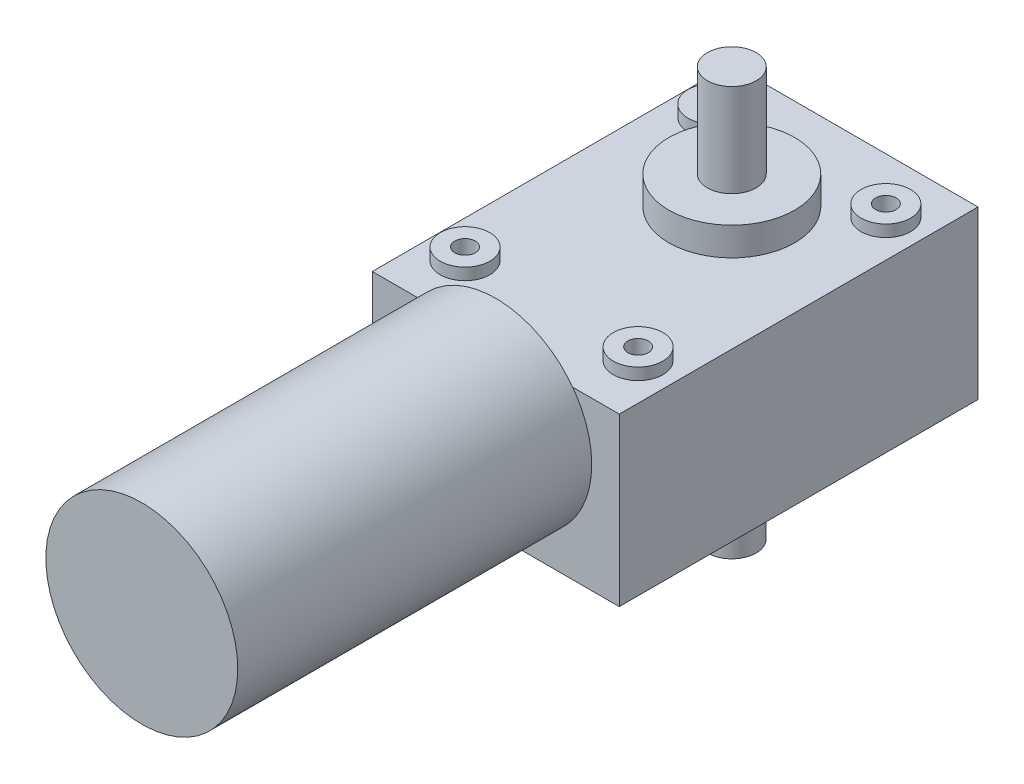
from build123d import *

# Parameters (mm, degrees)
SKETCH1_W            = 39.878
SKETCH1_H            = 57.912
BOSS_EXTRUDE1_DEPTH  = 26.924
SKETCH22_R           = 0.508
BOSS_EXTRUDE9_DEPTH  = 0.508
SKETCH3_R            = 10.16
BOSS_EXTRUDE2_DEPTH  = 4.572
BOSS_EXTRUDE3_START  = 4.572
SKETCH4_R            = 10.16
BOSS_EXTRUDE3_DEPTH  = 4.572
SKETCH5_R            = 3.937
BOSS_EXTRUDE4_DEPTH  = 14.986
BOSS_EXTRUDE5_START  = 14.986
SKETCH7_R            = 3.937
BOSS_EXTRUDE5_DEPTH  = 14.986
SKETCH8_R            = 15.494
BOSS_EXTRUDE6_DEPTH  = 57.15
SKETCH10_R           = 4.0005
BOSS_EXTRUDE7_DEPTH  = 1.905
LPATTERN1_COUNT      = 2
LPATTERN1_PITCH      = 40.00000128
LPATTERN1_COUNT_DIR2 = 2
LPATTERN1_PITCH_DIR2 = 27.94
BOSS_EXTRUDE8_START  = 1.905
SKETCH18_R           = 4.0005
BOSS_EXTRUDE8_DEPTH  = 1.905
LPATTERN3_COUNT      = 2
LPATTERN3_PITCH      = 27.94
LPATTERN3_COUNT_DIR2 = 2
LPATTERN3_PITCH_DIR2 = 40.00000128


with BuildPart() as part:
    # Sketch1 → Boss-Extrude1 (new body)
    with BuildSketch(Plane(origin=(0, 0, 0), x_dir=(1, 0, 0), z_dir=(0, 1, 0))):
        with Locations((19.939, 28.956)):
            Rectangle(SKETCH1_W, SKETCH1_H)
    extrude(amount=BOSS_EXTRUDE1_DEPTH)

    # Sketch3 → Boss-Extrude2 (add)
    with BuildSketch(Plane(origin=(0, 26.924, 0), x_dir=(1, 0, 0), z_dir=(0, 1, 0))):
        with Locations(Location((19.939, 38.1, 0), (0, 0, 270))):
            Circle(SKETCH3_R)
    extrude(amount=BOSS_EXTRUDE2_DEPTH)

    # Sketch4 → Boss-Extrude3 (add)
    with BuildSketch(Plane.XZ.offset(BOSS_EXTRUDE3_START)):
        with Locations(Location((19.939, -38.1, 0), (0, 0, 90))):
            Circle(SKETCH4_R)
    extrude(amount=-BOSS_EXTRUDE3_DEPTH)

    # Sketch5 → Boss-Extrude4 (add)
    with BuildSketch(Plane(origin=(0, 31.496, 0), x_dir=(1, 0, 0), z_dir=(0, 1, 0))):
        with Locations(Location((19.939, 38.1, 0), (0, 0, 270))):
            Circle(SKETCH5_R)
    extrude(amount=BOSS_EXTRUDE4_DEPTH)

    # Sketch7 → Boss-Extrude5 (add)
    with BuildSketch(Plane.XZ.offset(4.572).offset(BOSS_EXTRUDE5_START)):
        with Locations(Location((19.939, -38.1, 0), (0, 0, 90))):
            Circle(SKETCH7_R)
    extrude(amount=-BOSS_EXTRUDE5_DEPTH)

    # Sketch10 → Boss-Extrude7 (add)
    with BuildSketch(Plane(origin=(0, 26.924, 0), x_dir=(1, 0, 0), z_dir=(0, 1, 0))):
        with Locations(Location((5.9563, 9.017, 0), (0, 0, 90))):
            Circle(SKETCH10_R)
    boss_extrude7 = extrude(amount=BOSS_EXTRUDE7_DEPTH)

    # Sketch16 → M4x0.7 Tapped Hole1 (revolve, cut)
    with BuildSketch(Plane(origin=(5.9563, 28.829, -9.017), x_dir=(0, 0, 1), z_dir=(1, 0, 0))):
        Polygon((0, 0), (0, 10.008420021), (1.65, 9.017), (1.65, 0), align=None)
    m4x0_7_tapped_hole1 = revolve(axis=Axis((5.9563, 35.179, -9.017), (0, -1, 0)), mode=Mode.SUBTRACT)

    # LPattern1: Boss-Extrude7, M4x0.7 Tapped Hole1 2 × 2
    with Locations(*[(j * LPATTERN1_PITCH_DIR2, 0, -i * LPATTERN1_PITCH) for i in range(LPATTERN1_COUNT) for j in range(LPATTERN1_COUNT_DIR2) if (i, j) != (0, 0)]):
        add(boss_extrude7)
        add(m4x0_7_tapped_hole1, mode=Mode.SUBTRACT)

    # Sketch18 → Boss-Extrude8 (add)
    with BuildSketch(Plane.XZ.offset(BOSS_EXTRUDE8_START)):
        with Locations(Location((5.9563, -9.017, 0), (0, 0, 270))):
            Circle(SKETCH18_R)
    boss_extrude8 = extrude(amount=-BOSS_EXTRUDE8_DEPTH)

    # Sketch20 → M4x0.7 Tapped Hole2 (revolve, cut)
    with BuildSketch(Plane(origin=(5.815367122, -1.905, -9.279839525), x_dir=(0, 0, -1), z_dir=(1, 0, 0))):
        Polygon((0, 0), (0, 10.135420021), (1.65, 9.144), (1.65, 0), align=None)
    m4x0_7_tapped_hole2 = revolve(axis=Axis((5.815367122, -8.255, -9.279839525), (0, 1, 0)), mode=Mode.SUBTRACT)

    # LPattern3: Boss-Extrude8, M4x0.7 Tapped Hole2 2 × 2
    with Locations(*[(i * LPATTERN3_PITCH, 0, -j * LPATTERN3_PITCH_DIR2) for i in range(LPATTERN3_COUNT) for j in range(LPATTERN3_COUNT_DIR2) if (i, j) != (0, 0)]):
        add(boss_extrude8)
        add(m4x0_7_tapped_hole2, mode=Mode.SUBTRACT)


with BuildPart() as body_2:
    # Sketch22 → Boss-Extrude9 (new body)
    with BuildSketch(Plane.XZ):
        with Locations(Location((0.508, -0.508, 0), (0, 0, 270))):
            Circle(SKETCH22_R)
    extrude(amount=BOSS_EXTRUDE9_DEPTH)


with BuildPart() as body_3:
    # Sketch8 → Boss-Extrude6 (new body)
    with BuildSketch(Plane.XY):
        with Locations((19.939, 17.653)):
            Circle(SKETCH8_R)
    extrude(amount=BOSS_EXTRUDE6_DEPTH)


solid = Compound([part.part, body_2.part, body_3.part])
